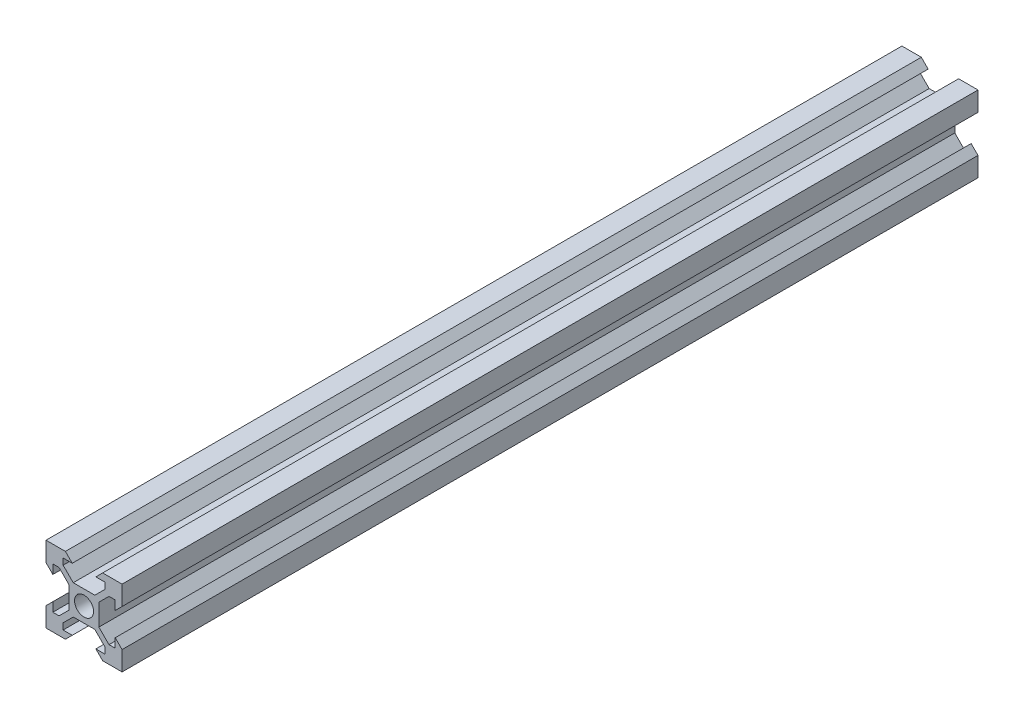
from build123d import *

# Parameters (mm, degrees)
SKETCH1_R           = 2.5
BOSS_EXTRUDE1_DEPTH = 225


with BuildPart() as part:
    # Sketch1 → Boss-Extrude1 (new body)
    with BuildSketch(Plane.XY):
        Polygon((2.839339828, 3.9), (-2.839339828, 3.9), (-5.5, 6.560660172), (-5.5, 8.2), (-3.1, 8.2), (-4.9, 10), (-10, 10), (-10, 4.9), (-8.2, 3.1), (-8.2, 5.5), (-6.560660172, 5.5), (-3.9, 2.839339828), (-3.9, -2.839339828), (-6.560660172, -5.5), (-8.2, -5.5), (-8.2, -3.1), (-10, -4.9), (-10, -10), (-4.9, -10), (-3.1, -8.2), (-5.5, -8.2), (-5.5, -6.560660172), (-2.839339828, -3.9), (2.839339828, -3.9), (5.5, -6.560660172), (5.5, -8.2), (3.1, -8.2), (4.9, -10), (10, -10), (10, -4.9), (8.2, -3.1), (8.2, -5.5), (6.560660172, -5.5), (3.9, -2.839339828), (3.9, 2.839339828), (6.560660172, 5.5), (8.2, 5.5), (8.2, 3.1), (10, 4.9), (10, 10), (4.9, 10), (3.1, 8.2), (5.5, 8.2), (5.5, 6.560660172), align=None)
        Circle(SKETCH1_R, mode=Mode.SUBTRACT)
    extrude(amount=BOSS_EXTRUDE1_DEPTH)


solid = part.part
